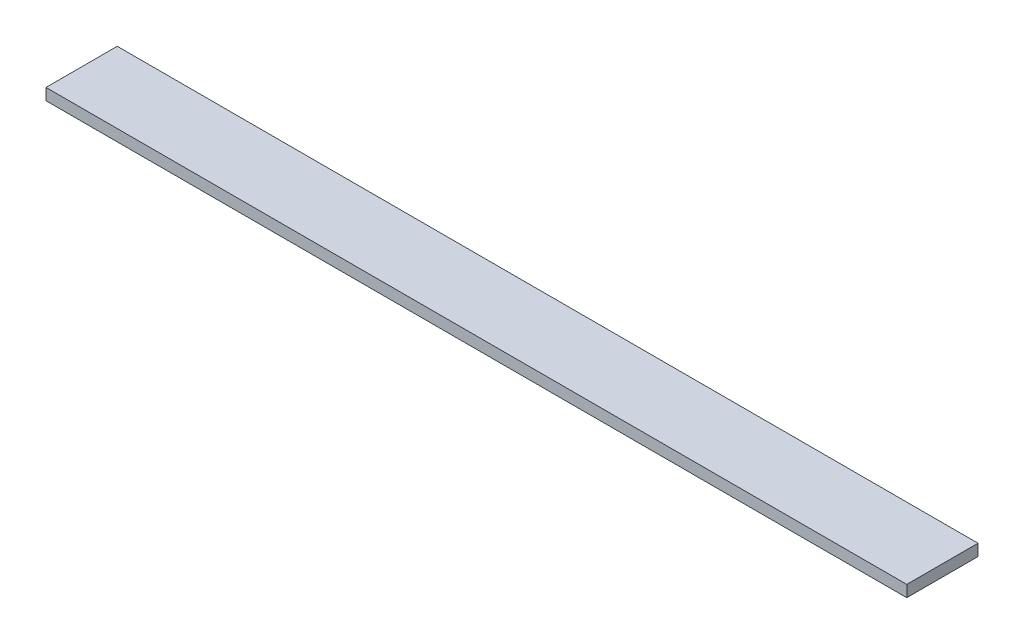
from build123d import *

# Parameters (mm, degrees)
SKETCH1_W           = 2838.45
SKETCH1_H           = 234.95
BOSS_EXTRUDE1_DEPTH = 38.1


with BuildPart() as part:
    # Sketch1 → Boss-Extrude1 (new body)
    with BuildSketch(Plane(origin=(0, 0, 0), x_dir=(1, 0, 0), z_dir=(0, 1, 0))):
        with Locations((698.051086957, 304.583695652)):
            Rectangle(SKETCH1_W, SKETCH1_H)
    extrude(amount=BOSS_EXTRUDE1_DEPTH)


solid = part.part
